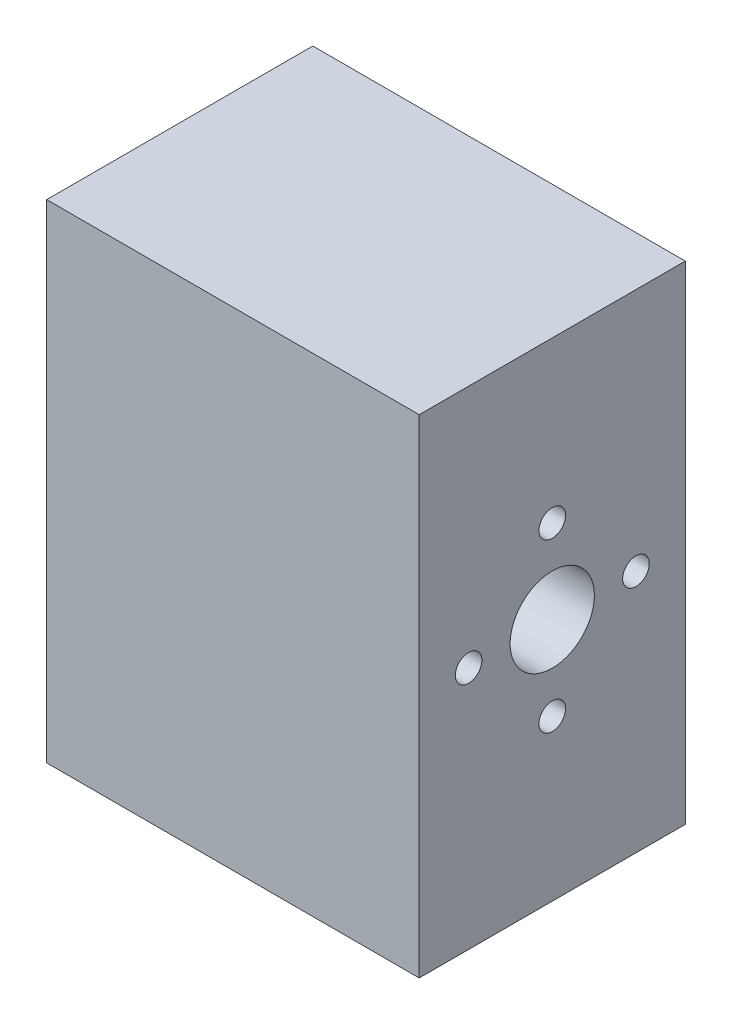
from build123d import *

# Parameters (mm, degrees)
SKETCH_1_W          = 42
SKETCH_1_H          = 55
EXTRUDE_1_DEPTH     = 30
SKETCH_2_R          = 4.75
SKETCH_2_R_2        = 1.5
CUT_EXTRUDE_1_DEPTH = 76.425459893


with BuildPart() as part:
    # Эскиз1 → Бобышка-Вытянуть1 (new body)
    with BuildSketch(Plane.XY):
        with Locations((21, 27.5)):
            Rectangle(SKETCH_1_W, SKETCH_1_H)
    extrude(amount=EXTRUDE_1_DEPTH)

    # Эскиз2 → Вырез-Вытянуть1 (cut, through all)
    with BuildSketch(Plane(origin=(42, 0, 0), x_dir=(0, 0, -1), z_dir=(1, 0, 0))):
        with Locations((-15, 27.5)):
            Circle(SKETCH_2_R)
        with Locations((-15, 36.934474839)):
            Circle(SKETCH_2_R_2)
        with Locations((-5.565525161, 27.5)):
            Circle(SKETCH_2_R_2)
        with Locations((-15, 18.065525161)):
            Circle(SKETCH_2_R_2)
        with Locations((-24.434474839, 27.5)):
            Circle(SKETCH_2_R_2)
    extrude(amount=-CUT_EXTRUDE_1_DEPTH, mode=Mode.SUBTRACT)


solid = part.part
